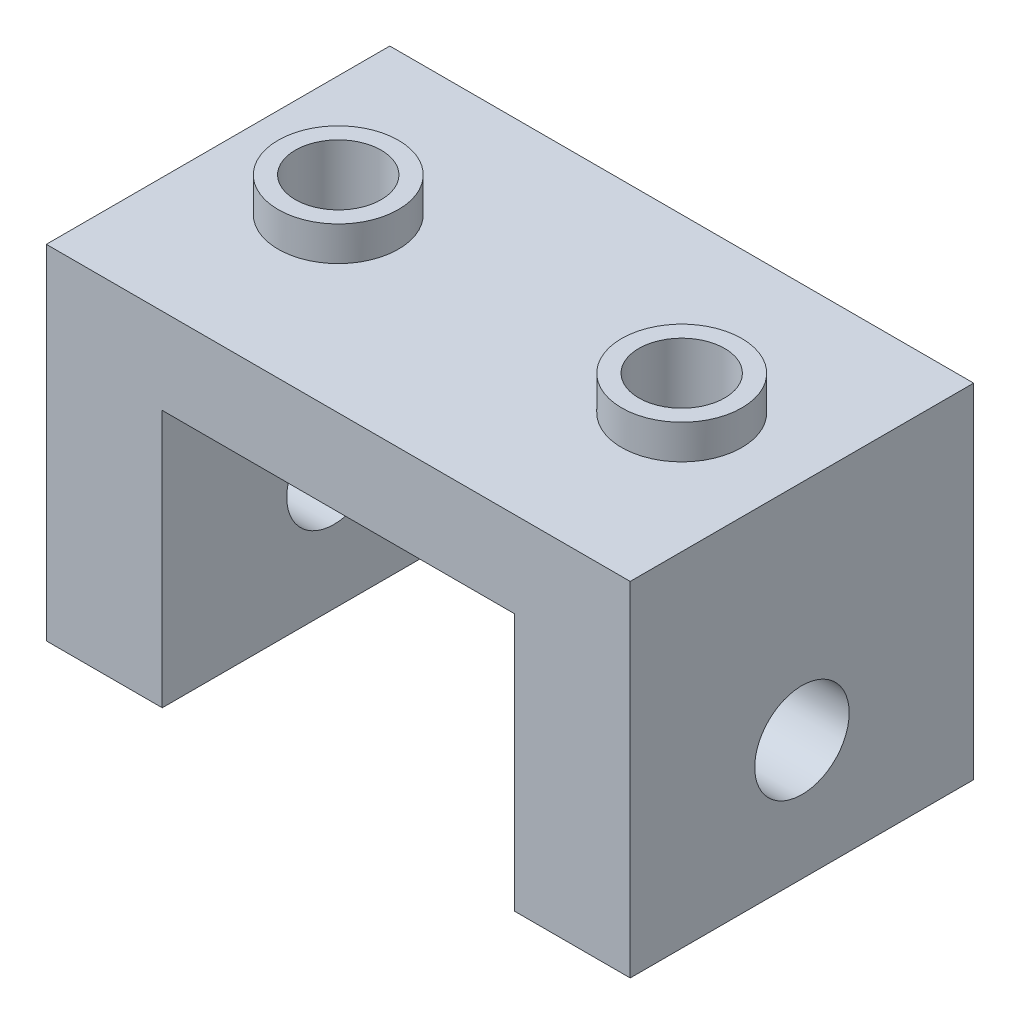
from build123d import *

# Parameters (mm, degrees)
SKETCH1_W            = 34
SKETCH1_H            = 20
BOSS_EXTRUDE1_DEPTH  = 5
SKETCH2_R            = 3.5
BOSS_EXTRUDE2_DEPTH  = 2
SKETCH3_R            = 2.5
CUT_EXTRUDE1_DEPTH   = 4.5
SKETCH4_W            = 6.75
SKETCH4_H            = 20
BOSS_EXTRUDE3_DEPTH  = 15
M5_CLEARANCE_HOLE1_D = 5.5


with BuildPart() as part:
    # Sketch1 → Boss-Extrude1 (new body)
    with BuildSketch(Plane(origin=(0, 0, 0), x_dir=(1, 0, 0), z_dir=(0, 1, 0))):
        Rectangle(SKETCH1_W, SKETCH1_H)
    extrude(amount=BOSS_EXTRUDE1_DEPTH)

    # Sketch2 → Boss-Extrude2 (add)
    with BuildSketch(Plane(origin=(0, 5, 0), x_dir=(1, 0, 0), z_dir=(0, 1, 0))):
        with Locations(Location((-10, 0, 0), (0, 0, 90))):
            Circle(SKETCH2_R)
        with Locations(Location((10, 0, 0), (0, 0, 90))):
            Circle(SKETCH2_R)
    extrude(amount=BOSS_EXTRUDE2_DEPTH)

    # Sketch3 → Cut-Extrude1 (cut)
    with BuildSketch(Plane(origin=(0, 7, 0), x_dir=(1, 0, 0), z_dir=(0, 1, 0))):
        with Locations(Location((-10, 0, 0), (0, 0, 270))):
            Circle(SKETCH3_R)
        with Locations(Location((10, 0, 0), (0, 0, 270))):
            Circle(SKETCH3_R)
    extrude(amount=-CUT_EXTRUDE1_DEPTH, mode=Mode.SUBTRACT)

    # Sketch4 → Boss-Extrude3 (add)
    with BuildSketch(Plane.XZ):
        with Locations((13.625, 0)):
            Rectangle(SKETCH4_W, SKETCH4_H)
        with Locations((-13.625, 0)):
            Rectangle(SKETCH4_W, SKETCH4_H)
    extrude(amount=BOSS_EXTRUDE3_DEPTH)

    # M5 Clearance Hole1 (through all)
    with Locations(Plane(origin=(17, -8, 0), x_dir=(0, 0, 1), z_dir=(1, 0, 0))):
        with Locations((0, 0)):
            Hole(M5_CLEARANCE_HOLE1_D / 2)


solid = part.part
